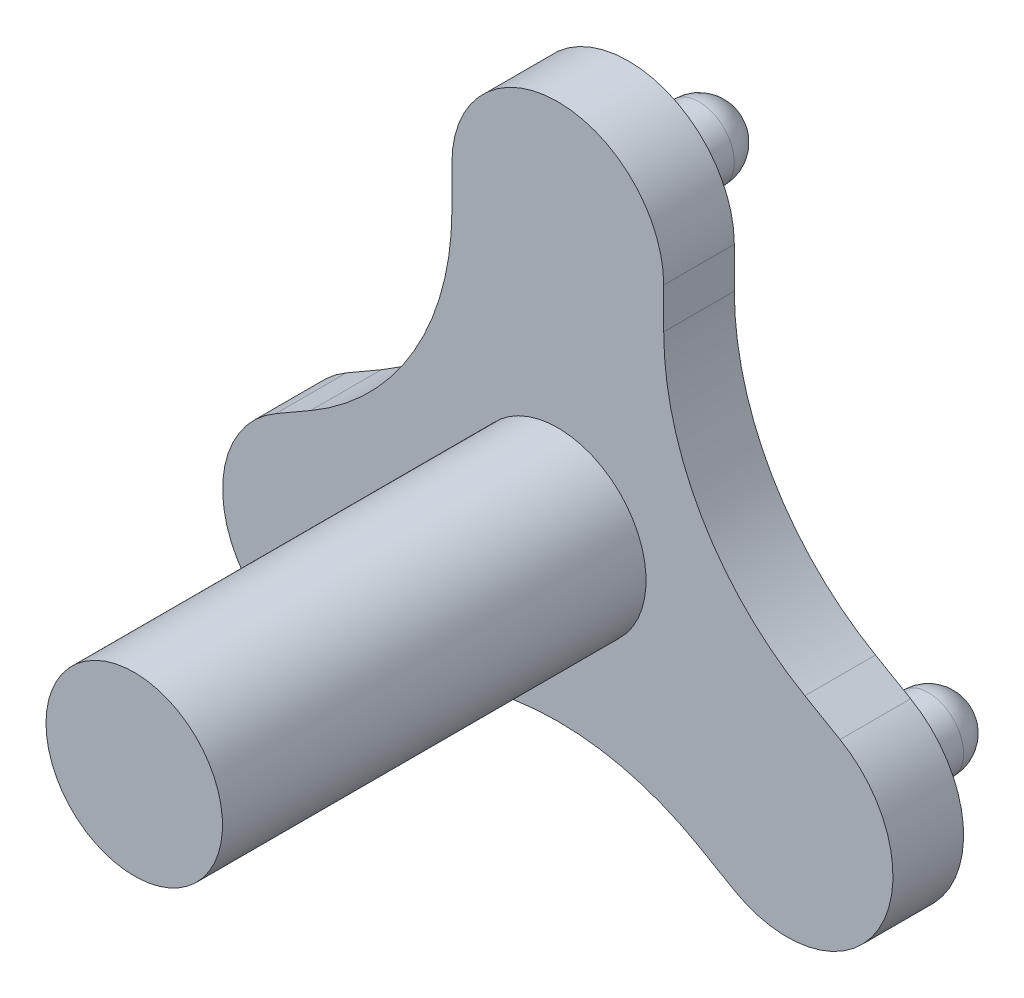
from build123d import *

# Parameters (mm, degrees)
BOSS_EXTRUDE1_DEPTH = 6.35
FILLET1_R           = 25.4
SKETCH3_R           = 3.175
BOSS_EXTRUDE2_DEPTH = 9.525
FILLET2_R           = 3.175
SKETCH4_R           = 7.9375
BOSS_EXTRUDE3_DEPTH = 38.1


with BuildPart() as part:
    # Sketch2 → Boss-Extrude1 (new body)
    with BuildSketch(Plane.XY):
        with BuildLine():
            Line((-15.859729928, -20.155141971), (0, -10.998522628))
            Line((0, -10.998522628), (15.859729928, -20.155141971))
            ThreePointArc((15.859729928, -20.155141971), (28.871121899, -16.66875), (25.384729928, -3.657358029))
            Line((25.384729928, -3.657358029), (9.525, 5.499261314))
            Line((9.525, 5.499261314), (9.525, 23.8125))
            ThreePointArc((9.525, 23.8125), (0, 33.3375), (-9.525, 23.8125))
            Line((-9.525, 23.8125), (-9.525, 5.499261314))
            Line((-9.525, 5.499261314), (-25.384729928, -3.657358029))
            ThreePointArc((-25.384729928, -3.657358029), (-28.871121899, -16.66875), (-15.859729928, -20.155141971))
        make_face()
    extrude(amount=BOSS_EXTRUDE1_DEPTH)

    # Fillet1
    fillet1_edges = [part.edges().sort_by_distance(p)[0] for p in [
        (-9.525, 5.499261314, 3.175),
        (9.525, 5.499261314, 3.175),
        (0, -10.998522628, 3.175),
    ]]
    fillet(fillet1_edges, radius=FILLET1_R)

    # Sketch3 → Boss-Extrude2 (add)
    with BuildSketch(Plane(origin=(0, 0, 0), x_dir=(-1, 0, 0), z_dir=(0, 0, -1))):
        with Locations(Location((0, 23.8125, 0), (0, 0, 180))):
            Circle(SKETCH3_R)
        with Locations(Location((20.622229928, -11.90625, 0), (0, 0, 180))):
            Circle(SKETCH3_R)
        with Locations(Location((-20.622229928, -11.90625, 0), (0, 0, 180))):
            Circle(SKETCH3_R)
    extrude(amount=BOSS_EXTRUDE2_DEPTH)

    # Fillet2
    fillet2_edges = [part.edges().sort_by_distance(p)[0] for p in [
        (-3.175, 23.8125, -9.525),
        (-23.797229928, -11.90625, -9.525),
        (17.447229928, -11.90625, -9.525),
    ]]
    fillet(fillet2_edges, radius=FILLET2_R)

    # Sketch4 → Boss-Extrude3 (add)
    with BuildSketch(Plane.XY.offset(6.35)):
        with Locations(Location((0, 0, 0), (0, 0, 180))):
            Circle(SKETCH4_R)
    extrude(amount=BOSS_EXTRUDE3_DEPTH)


solid = part.part
